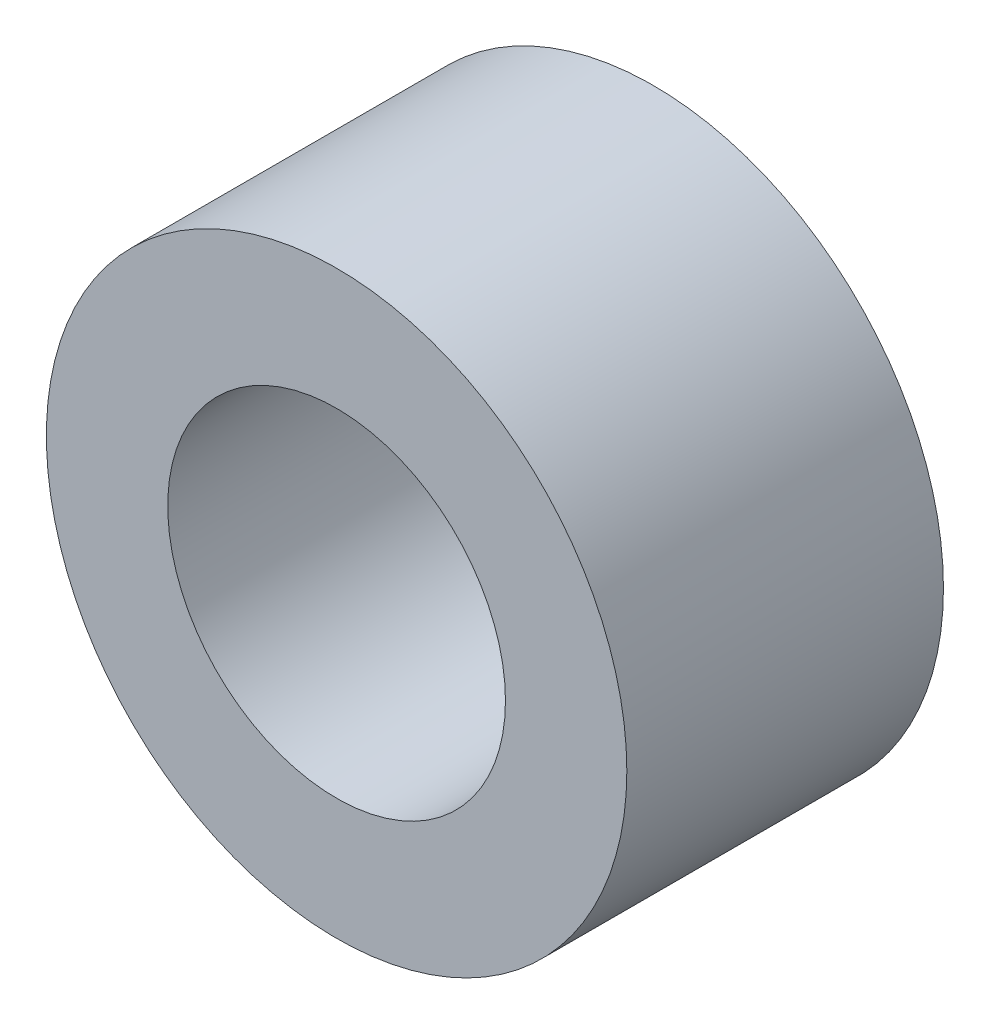
from build123d import *

# Parameters (mm, degrees)
SKETCH_1_R      = 2.75
SKETCH_1_R_2    = 1.6
EXTRUDE_1_DEPTH = 3


with BuildPart() as part:
    # ｽｹｯﾁ1 → ﾎﾞｽ - 押し出し1 (new body)
    with BuildSketch(Plane.XY):
        Circle(SKETCH_1_R)
        Circle(SKETCH_1_R_2, mode=Mode.SUBTRACT)
    extrude(amount=EXTRUDE_1_DEPTH)


solid = part.part
